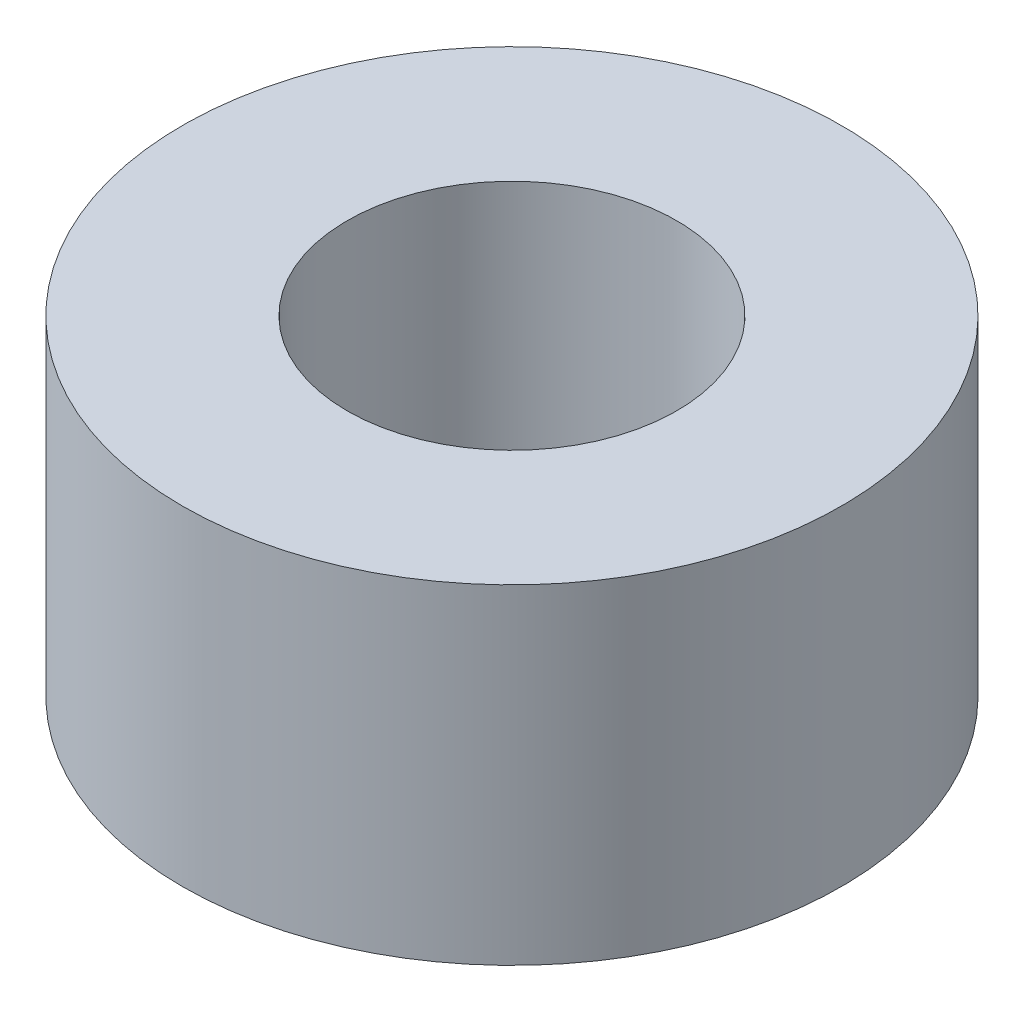
from build123d import *

# Parameters (mm, degrees)
SKETCH1_R           = 3
BOSS_EXTRUDE1_DEPTH = 3
SKETCH2_R           = 1.5
CUT_EXTRUDE1_DEPTH  = 3


with BuildPart() as part:
    # Sketch1 → Boss-Extrude1 (new body)
    with BuildSketch(Plane(origin=(0, 0, 0), x_dir=(1, 0, 0), z_dir=(0, 1, 0))):
        with Locations(Location((0, 0, 0), (0, 0, 270))):
            Circle(SKETCH1_R)
    extrude(amount=BOSS_EXTRUDE1_DEPTH)

    # Sketch2 → Cut-Extrude1 (cut)
    with BuildSketch(Plane(origin=(0, 3, 0), x_dir=(1, 0, 0), z_dir=(0, 1, 0))):
        with Locations(Location((0, 0, 0), (0, 0, 270))):
            Circle(SKETCH2_R)
    extrude(amount=-CUT_EXTRUDE1_DEPTH, mode=Mode.SUBTRACT)


solid = part.part
